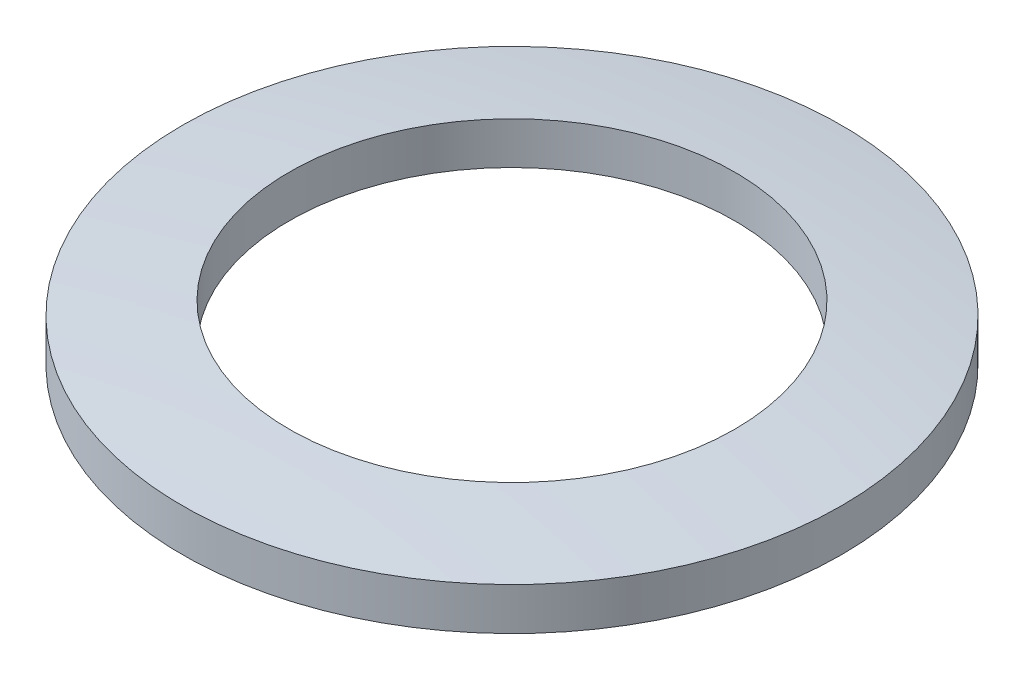
from build123d import *


with BuildPart() as part:
    # Sketch1 → Revolve1 (revolve)
    with BuildSketch(Plane.XY):
        with BuildLine():
            Line((26.51, 273.970404241), (26.51, 268.946616264))
            ThreePointArc((26.51, 268.946616264), (32.874227001, 268.243075771), (39.22, 267.388956578))
            Line((39.22, 267.388956578), (39.22, 272.441469127))
            ThreePointArc((39.22, 272.441469127), (32.873889877, 273.279838013), (26.51, 273.970404241))
        make_face()
    revolve(axis=Axis((0, 0, 0), (0, 1, 0)))


solid = part.part
